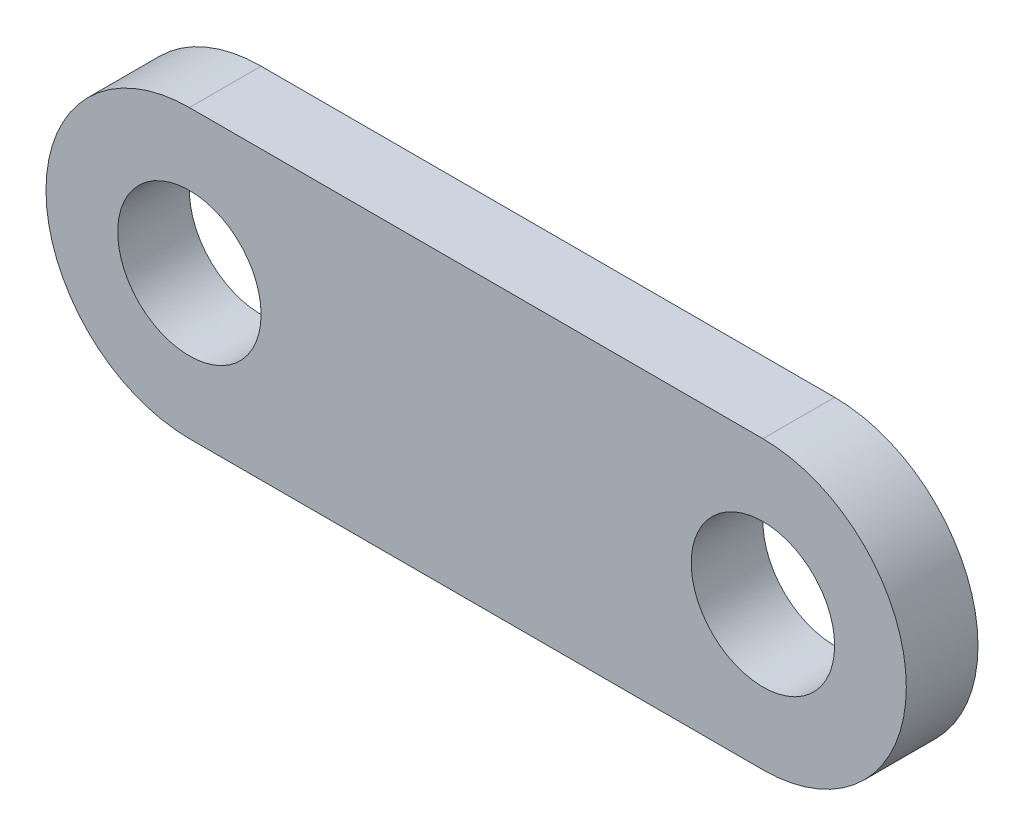
from build123d import *

# Parameters (mm, degrees)
IZIM1_R                     = 5
Y_KSEKLIK_EKSTR_ZYON1_DEPTH = 5


with BuildPart() as part:
    # Çizim1 → Yükseklik-Ekstrüzyon1 (new body)
    with BuildSketch(Plane.XY):
        with BuildLine():
            Line((-38.69815392, 12.886597938), (1.30184608, 12.886597938))
            ThreePointArc((1.30184608, 12.886597938), (11.30184608, 2.886597938), (1.30184608, -7.113402062))
            Line((1.30184608, -7.113402062), (-38.69815392, -7.113402062))
            ThreePointArc((-38.69815392, -7.113402062), (-48.69815392, 2.886597938), (-38.69815392, 12.886597938))
        make_face()
        with Locations((-38.69815392, 2.886597938)):
            Circle(IZIM1_R, mode=Mode.SUBTRACT)
        with Locations((1.30184608, 2.886597938)):
            Circle(IZIM1_R, mode=Mode.SUBTRACT)
    extrude(amount=Y_KSEKLIK_EKSTR_ZYON1_DEPTH)


solid = part.part
